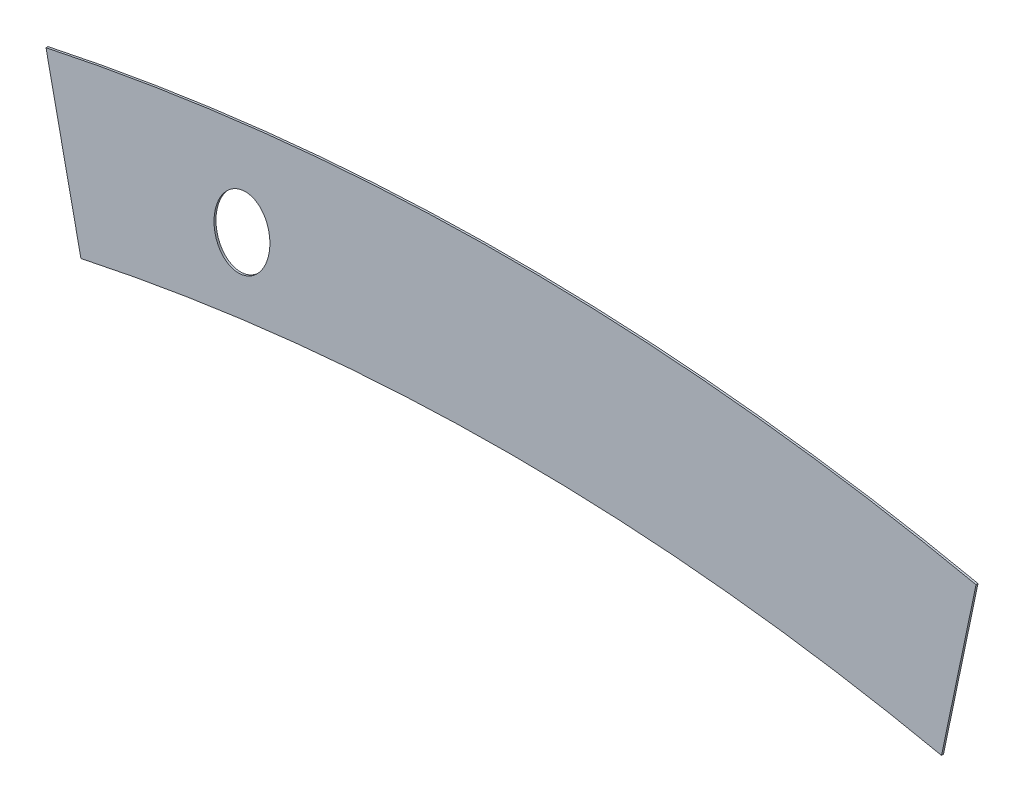
from build123d import *

# Parameters (mm, degrees)
SKETCH1_RX         = 60.325
SKETCH1_RY         = 44.45
BASE_EXTRUDE_DEPTH = 3.175


with BuildPart() as part:
    # Sketch1 → Base-Extrude (new body)
    with BuildSketch(Plane.XY):
        with BuildLine():
            Line((-752.475, -79.534806378), (-695.96, -346.672829287))
            ThreePointArc((-695.96, -346.672829287), (0.324693286, -273.050015847), (696.595, -346.808762803))
            Line((696.595, -346.808762803), (752.475, -79.534806378))
            ThreePointArc((752.475, -79.534806378), (0, 0), (-752.475, -79.534806378))
        make_face()
        with Locations(Location((-435.383088957, -179.737008178), (0, 0, -101.57))):
            Ellipse(SKETCH1_RX, SKETCH1_RY, mode=Mode.SUBTRACT)
    extrude(amount=-BASE_EXTRUDE_DEPTH)


solid = part.part
